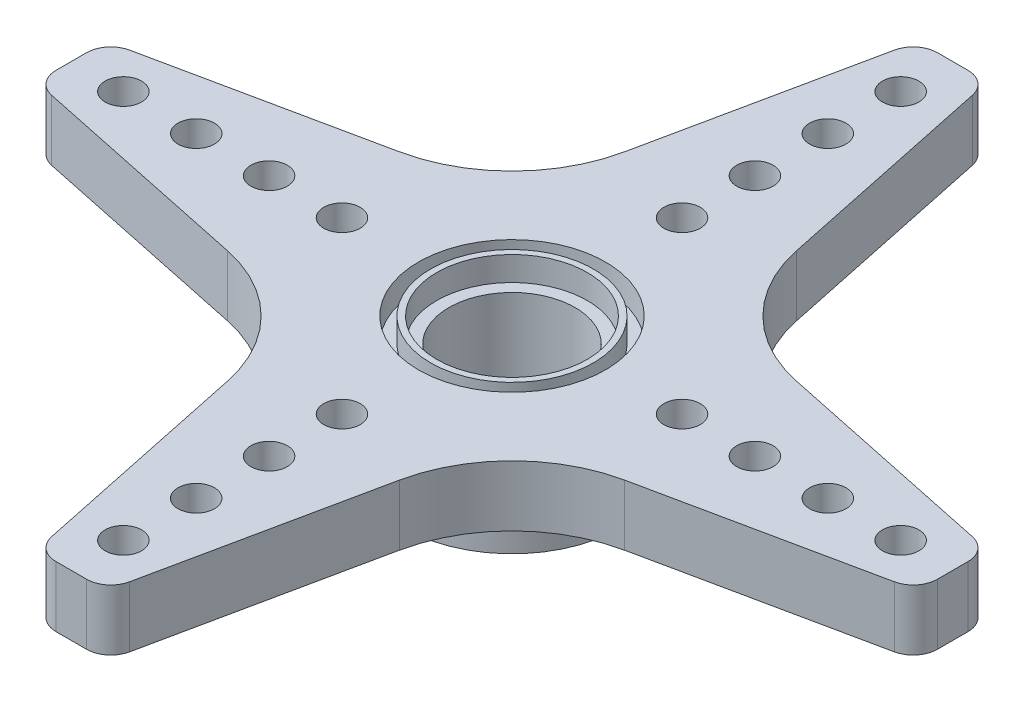
from build123d import *

# Parameters (mm, degrees)
SKETCH_1_R          = 4.5
SKETCH_1_R_2        = 2.6
EXTRUDE_1_DEPTH     = 2.8
SKETCH_2_R          = 0.75
SKETCH_2_R_2        = 2.6
EXTRUDE_4_DEPTH     = 2.5
CUT_EXTRUDE_START   = -1
SKETCH_4_R          = 3.85
SKETCH_4_R_2        = 3.35
SKETCH_4_R_3        = 3.1
SKETCH_4_R_4        = 2.6
CUT_EXTRUDE_1_DEPTH = 1


with BuildPart() as part:
    # 草图1 → 凸台-拉伸1 (new body)
    with BuildSketch(Plane(origin=(0, 0, 0), x_dir=(1, 0, 0), z_dir=(0, 1, 0))):
        with Locations(Location((0, 0, 0), (0, 0, 270))):
            Circle(SKETCH_1_R)
        with Locations(Location((0, 0, 0), (0, 0, 270))):
            Circle(SKETCH_1_R_2, mode=Mode.SUBTRACT)
    extrude(amount=EXTRUDE_1_DEPTH)

    # 草图2 → 凸台-拉伸4 (add)
    with BuildSketch(Plane(origin=(0, 2.8, 0), x_dir=(1, 0, 0), z_dir=(0, 1, 0))):
        with BuildLine():
            Line((-17.34846223, 1.606822932), (-8.172576507, 3.533758933))
            ThreePointArc((-8.172576507, 3.533758933), (-5.163039226, 5.163039226), (-3.533758933, 8.172576507))
            Line((-3.533758933, 8.172576507), (-1.606822932, 17.34846223))
            ThreePointArc((-1.606822932, 17.34846223), (-1.258440316, 17.919320303), (-0.628169435, 18.142944996))
            Line((-0.628169435, 18.142944996), (0.628169435, 18.142944996))
            ThreePointArc((0.628169435, 18.142944996), (1.258440316, 17.919320303), (1.606822932, 17.34846223))
            Line((1.606822932, 17.34846223), (3.533758933, 8.172576507))
            ThreePointArc((3.533758933, 8.172576507), (5.163039226, 5.163039226), (8.172576507, 3.533758933))
            Line((8.172576507, 3.533758933), (17.34846223, 1.606822932))
            ThreePointArc((17.34846223, 1.606822932), (17.919320303, 1.258440316), (18.142944996, 0.628169435))
            Line((18.142944996, 0.628169435), (18.142944996, -0.628169435))
            ThreePointArc((18.142944996, -0.628169435), (17.919320303, -1.258440316), (17.34846223, -1.606822932))
            Line((17.34846223, -1.606822932), (8.172576507, -3.533758933))
            ThreePointArc((8.172576507, -3.533758933), (5.163039226, -5.163039226), (3.533758933, -8.172576507))
            Line((3.533758933, -8.172576507), (1.606822932, -17.34846223))
            ThreePointArc((1.606822932, -17.34846223), (1.258440316, -17.919320303), (0.628169435, -18.142944996))
            Line((0.628169435, -18.142944996), (-0.628169435, -18.142944996))
            ThreePointArc((-0.628169435, -18.142944996), (-1.258440316, -17.919320303), (-1.606822932, -17.34846223))
            Line((-1.606822932, -17.34846223), (-3.533758933, -8.172576507))
            ThreePointArc((-3.533758933, -8.172576507), (-5.163039226, -5.163039226), (-8.172576507, -3.533758933))
            Line((-8.172576507, -3.533758933), (-17.34846223, -1.606822932))
            ThreePointArc((-17.34846223, -1.606822932), (-17.919320303, -1.258440316), (-18.142944996, -0.628169435))
            Line((-18.142944996, -0.628169435), (-18.142944996, 0.628169435))
            ThreePointArc((-18.142944996, 0.628169435), (-17.919320303, 1.258440316), (-17.34846223, 1.606822932))
        make_face()
        with Locations(Location((-7, 0, 0), (0, 0, 270))):
            Circle(SKETCH_2_R, mode=Mode.SUBTRACT)
        with Locations(Location((-10, 0, 0), (0, 0, 270))):
            Circle(SKETCH_2_R, mode=Mode.SUBTRACT)
        with Locations(Location((-13, 0, 0), (0, 0, 270))):
            Circle(SKETCH_2_R, mode=Mode.SUBTRACT)
        with Locations(Location((-16, 0, 0), (0, 0, 270))):
            Circle(SKETCH_2_R, mode=Mode.SUBTRACT)
        with Locations(Location((0, 7, 0), (0, 0, 270))):
            Circle(SKETCH_2_R, mode=Mode.SUBTRACT)
        with Locations(Location((0, 10, 0), (0, 0, 270))):
            Circle(SKETCH_2_R, mode=Mode.SUBTRACT)
        with Locations(Location((0, 13, 0), (0, 0, 270))):
            Circle(SKETCH_2_R, mode=Mode.SUBTRACT)
        with Locations(Location((0, 16, 0), (0, 0, 270))):
            Circle(SKETCH_2_R, mode=Mode.SUBTRACT)
        with Locations(Location((7, 0, 0), (0, 0, 270))):
            Circle(SKETCH_2_R, mode=Mode.SUBTRACT)
        with Locations(Location((10, 0, 0), (0, 0, 270))):
            Circle(SKETCH_2_R, mode=Mode.SUBTRACT)
        with Locations(Location((13, 0, 0), (0, 0, 270))):
            Circle(SKETCH_2_R, mode=Mode.SUBTRACT)
        with Locations(Location((16, 0, 0), (0, 0, 270))):
            Circle(SKETCH_2_R, mode=Mode.SUBTRACT)
        with Locations(Location((0, -7, 0), (0, 0, 270))):
            Circle(SKETCH_2_R, mode=Mode.SUBTRACT)
        with Locations(Location((0, -10, 0), (0, 0, 270))):
            Circle(SKETCH_2_R, mode=Mode.SUBTRACT)
        with Locations(Location((0, -13, 0), (0, 0, 270))):
            Circle(SKETCH_2_R, mode=Mode.SUBTRACT)
        with Locations(Location((0, -16, 0), (0, 0, 270))):
            Circle(SKETCH_2_R, mode=Mode.SUBTRACT)
        with Locations(Location((0, 0, 0), (0, 0, 270))):
            Circle(SKETCH_2_R_2, mode=Mode.SUBTRACT)
    extrude(amount=EXTRUDE_4_DEPTH)

    # 草图4 → 切除-拉伸1 (cut)
    # profile 1 of 2: a face of its own
    with BuildSketch(Plane(origin=(0, 5.3, 0), x_dir=(1, 0, 0), z_dir=(0, 1, 0)).offset(CUT_EXTRUDE_START)):
        with Locations(Location((0, 0, 0), (0, 0, 270))):
            Circle(SKETCH_4_R)
        with Locations(Location((0, 0, 0), (0, 0, 270))):
            Circle(SKETCH_4_R_2, mode=Mode.SUBTRACT)
    # profile 2 of 2: a face of its own
    with BuildSketch(Plane(origin=(0, 5.3, 0), x_dir=(1, 0, 0), z_dir=(0, 1, 0)).offset(CUT_EXTRUDE_START)):
        with Locations(Location((0, 0, 0), (0, 0, 270))):
            Circle(SKETCH_4_R_3)
        with Locations(Location((0, 0, 0), (0, 0, 270))):
            Circle(SKETCH_4_R_4, mode=Mode.SUBTRACT)
    extrude(amount=CUT_EXTRUDE_1_DEPTH, mode=Mode.SUBTRACT)


solid = part.part
